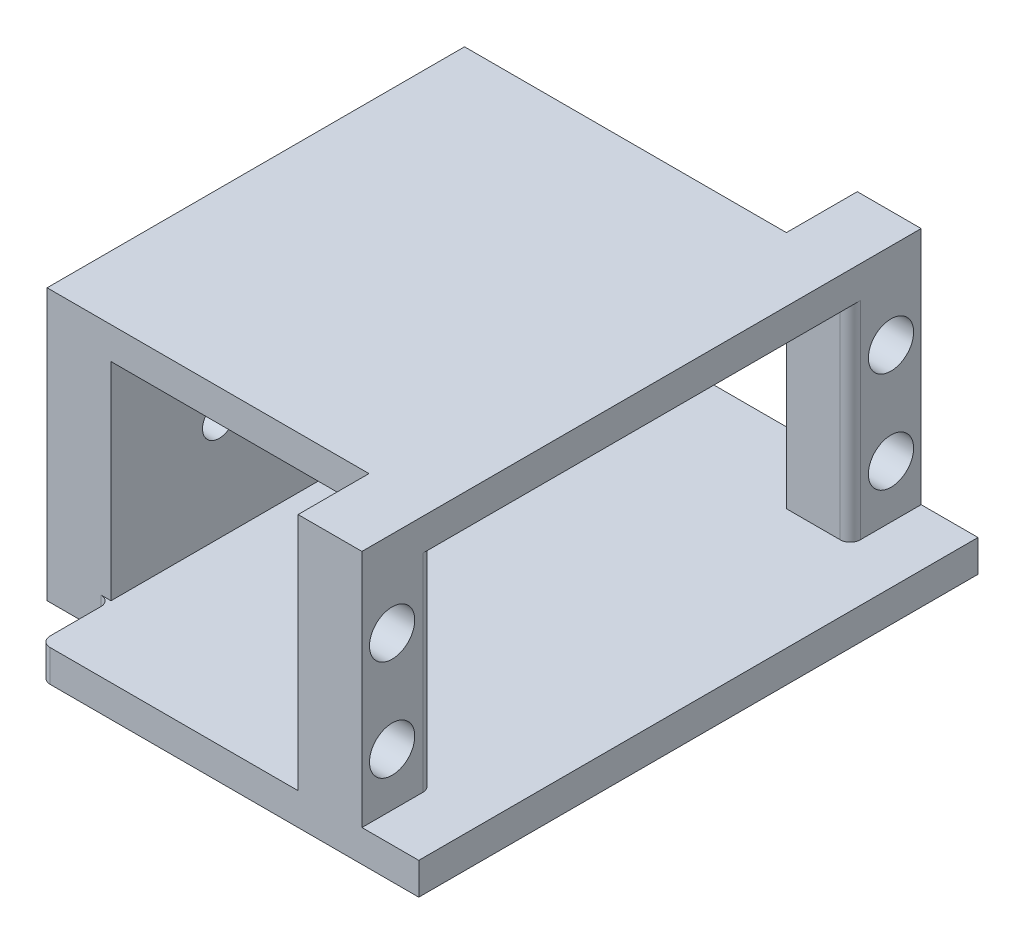
from build123d import *

# Parameters (mm, degrees)
SKETCH1_W           = 44
SKETCH1_H           = 55.6
BOSS_EXTRUDE1_DEPTH = 3.175
SKETCH2_W           = 6.35
SKETCH2_H           = 41.5
SKETCH2_H_2         = 7.05
BOSS_EXTRUDE2_DEPTH = 20.6
BOSS_EXTRUDE3_DEPTH = 3.175
SKETCH5_R           = 2.25
CUT_EXTRUDE2_DEPTH  = 6.35
SKETCH6_R           = 1.65
CUT_EXTRUDE3_DEPTH  = 6.35
FILLET1_R           = 1
SKETCH7_W           = 6.35
SKETCH7_H           = 7.05
CUT_EXTRUDE4_DEPTH  = 3.175
FILLET2_R           = 1


with BuildPart() as part:
    # Sketch1 → Boss-Extrude1 (new body)
    with BuildSketch(Plane(origin=(0, 0, 0), x_dir=(1, 0, 0), z_dir=(0, 1, 0))):
        Rectangle(SKETCH1_W, SKETCH1_H)
    extrude(amount=BOSS_EXTRUDE1_DEPTH)

    # Sketch2 → Boss-Extrude2 (add)
    with BuildSketch(Plane(origin=(0, 3.175, 0), x_dir=(1, 0, 0), z_dir=(0, 1, 0))):
        with Locations((-18.825, 0)):
            Rectangle(SKETCH2_W, SKETCH2_H)
        with Locations((13.175, 24.275)):
            Rectangle(SKETCH2_W, SKETCH2_H_2)
        with Locations((13.175, -24.275)):
            Rectangle(SKETCH2_W, SKETCH2_H_2)
    extrude(amount=BOSS_EXTRUDE2_DEPTH)

    # Sketch3 → Boss-Extrude3 (add)
    with BuildSketch(Plane(origin=(0, 23.775, 0), x_dir=(1, 0, 0), z_dir=(0, 1, 0))):
        Polygon((-22, 20.75), (10, 20.75), (10, 27.8), (16.35, 27.8), (16.35, -27.8), (10, -27.8), (10, -20.75), (-22, -20.75), align=None)
    extrude(amount=BOSS_EXTRUDE3_DEPTH)

    # Sketch5 → Cut-Extrude2 (cut)
    with BuildSketch(Plane(origin=(16.35, 0, 0), x_dir=(0, 0, -1), z_dir=(1, 0, 0))):
        with Locations((-24.8, 8.425)):
            Circle(SKETCH5_R)
        with Locations((-24.8, 18.425)):
            Circle(SKETCH5_R)
        with Locations((24.8, 18.425)):
            Circle(SKETCH5_R)
        with Locations((24.8, 8.425)):
            Circle(SKETCH5_R)
    extrude(amount=-CUT_EXTRUDE2_DEPTH, mode=Mode.SUBTRACT)

    # Sketch6 → Cut-Extrude3 (cut)
    with BuildSketch(Plane.ZY.offset(22)):
        with Locations((10, 13.43)):
            Circle(SKETCH6_R)
    extrude(amount=-CUT_EXTRUDE3_DEPTH, mode=Mode.SUBTRACT)

    # Fillet1
    fillet1_edges = [part.edges().sort_by_distance(p)[0] for p in [
        (16.35, 13.475, 20.75),
        (16.35, 13.475, -20.75),
    ]]
    fillet(fillet1_edges, radius=FILLET1_R)

    # Sketch7 → Cut-Extrude4 (cut)
    with BuildSketch(Plane(origin=(0, 3.175, 0), x_dir=(1, 0, 0), z_dir=(0, 1, 0))):
        with Locations((-18.825, -24.275)):
            Rectangle(SKETCH7_W, SKETCH7_H)
        with Locations((-18.825, 24.275)):
            Rectangle(SKETCH7_W, SKETCH7_H)
    extrude(amount=-CUT_EXTRUDE4_DEPTH, mode=Mode.SUBTRACT)

    # Fillet2
    fillet2_edges = [part.edges().sort_by_distance(p)[0] for p in [
        (-15.65, 1.5875, 20.75),
        (-15.65, 1.5875, 27.8),
        (-15.65, 1.5875, -27.8),
        (-15.65, 1.5875, -20.75),
    ]]
    fillet(fillet2_edges, radius=FILLET2_R)


solid = part.part
